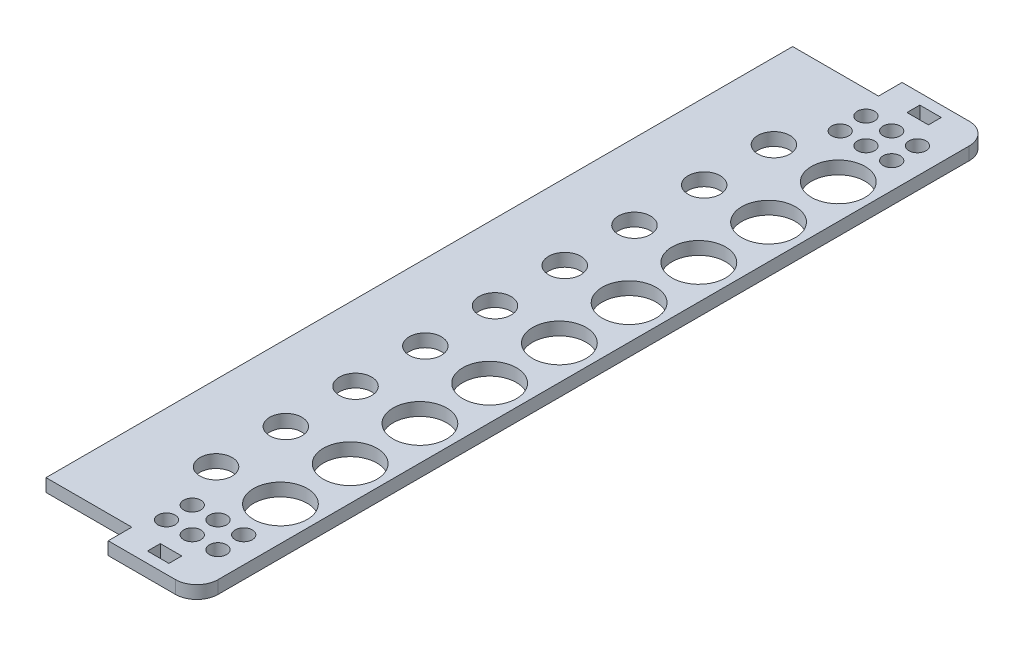
from build123d import *

# Parameters (mm, degrees)
ESQUISSE1_W             = 10
ESQUISSE1_H             = 6
BOSS_EXTRU_1_DEPTH      = 6
ESQUISSE2_R             = 12.5
ESQUISSE2_R_2           = 7.5
ENL_V_MAT_EXTRU_1_DEPTH = 6
ESQUISSE4_R             = 4
ENL_V_MAT_EXTRU_2_DEPTH = 6
CONG_1_R                = 10


with BuildPart() as part:
    # Esquisse1 → Boss.-Extru.1 (new body)
    with BuildSketch(Plane(origin=(0, 0, 0), x_dir=(1, 0, 0), z_dir=(0, 1, 0))):
        Polygon((-14.271309642, 359), (-14.271309642, 11), (25.728690358, 11), (25.728690358, 0), (67, 0), (67, 370), (25.728690358, 370), (25.728690358, 359), align=None)
        with Locations((44, 8)):
            Rectangle(ESQUISSE1_W, ESQUISSE1_H, mode=Mode.SUBTRACT)
        with Locations((44, 362)):
            Rectangle(ESQUISSE1_W, ESQUISSE1_H, mode=Mode.SUBTRACT)
    extrude(amount=BOSS_EXTRU_1_DEPTH)

    # Esquisse2 → Enlèv. mat.-Extru.1 (cut)
    with BuildSketch(Plane(origin=(0, 6, 0), x_dir=(1, 0, 0), z_dir=(0, 1, 0))):
        with Locations((51, 315)):
            Circle(ESQUISSE2_R)
        with Locations((51, 282.5)):
            Circle(ESQUISSE2_R)
        with Locations((51, 250)):
            Circle(ESQUISSE2_R)
        with Locations((51, 217.5)):
            Circle(ESQUISSE2_R)
        with Locations((51, 185)):
            Circle(ESQUISSE2_R)
        with Locations((51, 152.5)):
            Circle(ESQUISSE2_R)
        with Locations((51, 120)):
            Circle(ESQUISSE2_R)
        with Locations((51, 87.5)):
            Circle(ESQUISSE2_R)
        with Locations((51, 55)):
            Circle(ESQUISSE2_R)
        with Locations((21, 315)):
            Circle(ESQUISSE2_R_2)
        with Locations((21, 282.5)):
            Circle(ESQUISSE2_R_2)
        with Locations((21, 250)):
            Circle(ESQUISSE2_R_2)
        with Locations((21, 217.5)):
            Circle(ESQUISSE2_R_2)
        with Locations((21, 185)):
            Circle(ESQUISSE2_R_2)
        with Locations((21, 152.5)):
            Circle(ESQUISSE2_R_2)
        with Locations((21, 120)):
            Circle(ESQUISSE2_R_2)
        with Locations((21, 87.5)):
            Circle(ESQUISSE2_R_2)
        with Locations((21, 55)):
            Circle(ESQUISSE2_R_2)
    extrude(amount=-ENL_V_MAT_EXTRU_1_DEPTH, mode=Mode.SUBTRACT)

    # Esquisse4 → Enlèv. mat.-Extru.2 (cut)
    with BuildSketch(Plane(origin=(0, 6, 0), x_dir=(1, 0, 0), z_dir=(0, 1, 0))):
        with Locations((54.886501567, 22)):
            Circle(ESQUISSE4_R)
        with Locations((42.886501567, 22)):
            Circle(ESQUISSE4_R)
        with Locations((30.886501567, 22)):
            Circle(ESQUISSE4_R)
        with Locations((42.886501567, 34)):
            Circle(ESQUISSE4_R)
        with Locations((30.886501567, 34)):
            Circle(ESQUISSE4_R)
        with Locations((54.886501567, 34)):
            Circle(ESQUISSE4_R)
        with Locations((54.886501567, 336)):
            Circle(ESQUISSE4_R)
        with Locations((30.886501567, 336)):
            Circle(ESQUISSE4_R)
        with Locations((42.886501567, 336)):
            Circle(ESQUISSE4_R)
        with Locations((30.886501567, 348)):
            Circle(ESQUISSE4_R)
        with Locations((42.886501567, 348)):
            Circle(ESQUISSE4_R)
        with Locations((54.886501567, 348)):
            Circle(ESQUISSE4_R)
    extrude(amount=-ENL_V_MAT_EXTRU_2_DEPTH, mode=Mode.SUBTRACT)

    # Congé1
    cong_1_edges = [part.edges().sort_by_distance(p)[0] for p in [
        (67, 3, -370),
        (67, 3, 0),
    ]]
    fillet(cong_1_edges, radius=CONG_1_R)


solid = part.part
